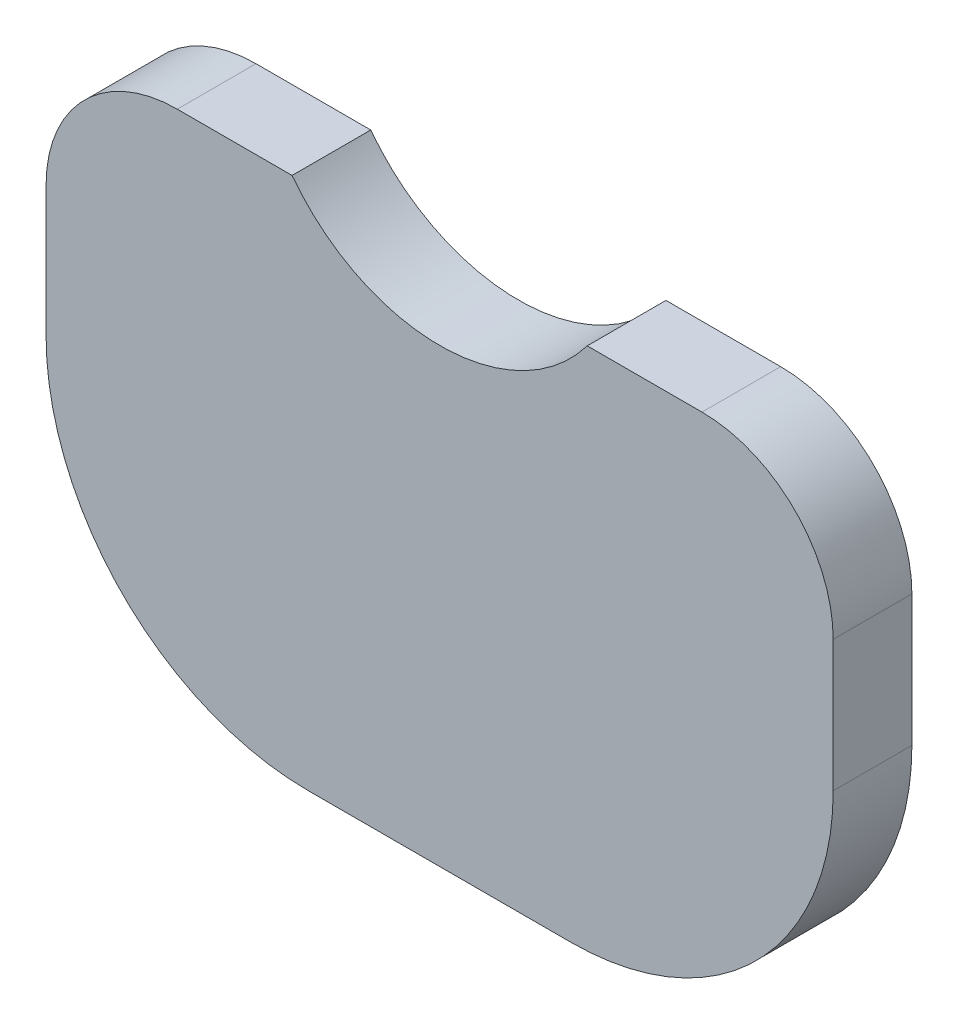
from build123d import *

# Parameters (mm, degrees)
EXTRUDE_1_DEPTH = 6
SKETCH_3_R      = 7.5
EXTRUDE_2_DEPTH = 6.5


with BuildPart() as part:
    # 草图1 → 凸台-拉伸1 (new body)
    with BuildSketch(Plane.XY):
        with BuildLine():
            Line((-10, -20), (10, -20))
            ThreePointArc((10, -20), (24.142135624, -14.142135624), (30, 0))
            Line((30, 0), (30, 10))
            ThreePointArc((30, 10), (27.071067812, 17.071067812), (20, 20))
            Line((20, 20), (11.249888888, 20))
            ThreePointArc((11.249888888, 20), (0, 14.4), (-11.249888888, 20))
            Line((-11.249888888, 20), (-20, 20))
            ThreePointArc((-20, 20), (-27.071067812, 17.071067812), (-30, 10))
            Line((-30, 10), (-30, 0))
            ThreePointArc((-30, 0), (-24.142135624, -14.142135624), (-10, -20))
        make_face()
    extrude(amount=EXTRUDE_1_DEPTH)

    # 草图3 → 凸台-拉伸2 (add)
    with BuildSketch(Plane.XY):
        with Locations((-12.5, 0)):
            Circle(SKETCH_3_R)
        with Locations((12.5, 0)):
            Circle(SKETCH_3_R)
    extrude(amount=-EXTRUDE_2_DEPTH)


solid = part.part
